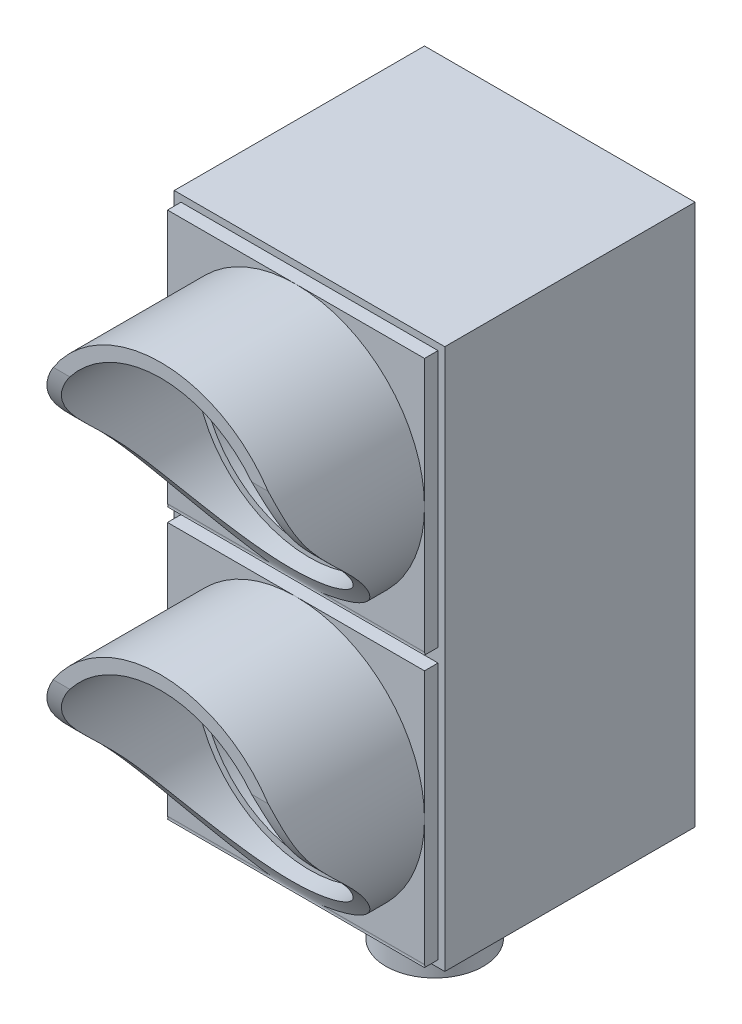
from build123d import *
from build123d.topology import SkipClean

# Parameters (mm, degrees)
SKETCH1_W                  = 40
SKETCH1_H                  = 40
BOSS_EXTRUDE1_DEPTH        = 15
SKETCH4_W                  = 38
SKETCH4_H                  = 38
BOSS_EXTRUDE2_DEPTH        = 2
SKETCH6_R                  = 19
SKETCH6_R_2                = 17
BOSS_EXTRUDE4_DEPTH        = 20
ENL_V_MAT_EXTRU_1_DEPTH    = 216.409731765
ESQUISSE3_R                = 16
ENL_V_MAT_EXTRU_7_DEPTH    = 224.368324091
ESQUISSE3_4_R              = 17
ESQUISSE3_4_R_2            = 16
ENL_V_MAT_EXTRU_8_DEPTH    = 2
ENL_V_START                = -2
SKETCH4_2_W                = 38
SKETCH4_2_H                = 38
ENL_V_MAT_EXTRU_9_DEPTH    = 222.556275259
ESQUISSE7_W                = 40
ESQUISSE7_H                = 40
BOSS_EXTRU_1_DEPTH         = 2
ESQUISSE8_R                = 1.5
ENL_V_MAT_EXTRU_10_DEPTH   = 2
R_P_TITION_LIN_AIRE1_COUNT = 2
R_P_TITION_LIN_AIRE1_PITCH = 40
ESQUISSE9_W                = 40
ESQUISSE9_H                = 80
ESQUISSE9_W_2              = 36
ESQUISSE9_H_2              = 76
BOSS_EXTRU_2_DEPTH         = 20
ESQUISSE10_R               = 2.5
ESQUISSE10_R_2             = 1.5
BOSS_EXTRU_8_DEPTH         = 12
ESQUISSE10_4_R             = 1.5
BOSS_EXTRU_9_DEPTH         = 7
ESQUISSE11_R               = 7.2
ESQUISSE11_R_2             = 5.2
BOSS_EXTRU_10_DEPTH        = 15
ESQUISSE11_2_R             = 5.2
ENL_V_MAT_EXTRU_12_DEPTH   = 2
ESQUISSE13_W               = 9
ESQUISSE13_H               = 4
ENL_V_MAT_EXTRU_13_DEPTH   = 2


with BuildPart() as part:
    # Sketch1 → Boss-Extrude1 (new body)
    with BuildSketch(Plane.XY):
        with Locations((-57.34375, 188.59375)):
            Rectangle(SKETCH1_W, SKETCH1_H)
    extrude(amount=BOSS_EXTRUDE1_DEPTH)

    # Sketch4 → Boss-Extrude2 (add)
    with BuildSketch(Plane.XY.offset(15)):
        with Locations((-57.34375, 188.59375)):
            Rectangle(SKETCH4_W, SKETCH4_H)
    extrude(amount=BOSS_EXTRUDE2_DEPTH)

    # Sketch6 → Boss-Extrude4 (add)
    with BuildSketch(Plane.XY.offset(17)):
        with Locations((-57.34375, 188.59375)):
            Circle(SKETCH6_R)
        with Locations((-57.34375, 188.59375)):
            Circle(SKETCH6_R_2, mode=Mode.SUBTRACT)
    extrude(amount=BOSS_EXTRUDE4_DEPTH)

    # Sketch8 → Enlèv. mat.-Extru.1 (cut, through all)
    with BuildSketch(Plane(origin=(-38.34375, 0, 0), x_dir=(0, 0, -1), z_dir=(1, 0, 0))):
        with BuildLine():
            Line((-37, 207.59375), (-205.499628683, 197.623288095))
            Line((-205.499628683, 197.623288095), (-205.499628683, 76.933932991))
            Line((-205.499628683, 76.933932991), (-192.249814342, 45.926786422))
            Line((-192.249814342, 45.926786422), (-17, 68.82437158))
            Line((-17, 68.82437158), (-17, 169.59375))
            add(Edge.make_bspline(
                [(-37, 207.59375), (-38.602349821, 191.852070618), (-28.700479497, 190.041130282), (-16.384432192, 169.883189568), (-17, 169.59375)],
                knots=[0, 0, 0, 0, 0.615781196, 1, 1, 1, 1], degree=3))
        make_face()
    extrude(amount=-ENL_V_MAT_EXTRU_1_DEPTH, mode=Mode.SUBTRACT)

    # Esquisse3 → Enlèv. mat.-Extru.7 (cut, through all)
    with BuildSketch(Plane.XY.offset(17)):
        with Locations((-57.34375, 188.59375)):
            Circle(ESQUISSE3_R)
    extrude(amount=-ENL_V_MAT_EXTRU_7_DEPTH, mode=Mode.SUBTRACT)

    # Esquisse3<4> → Enlèv. mat.-Extru.8 (cut)
    with SkipClean():  # the faces are left unmerged after this step: merging them gives an invalid solid
        with BuildSketch(Plane.XY.offset(17)):
            with Locations(Location((-57.34375, 188.59375, 0), (0, 0, 142.189607985))):
                Circle(ESQUISSE3_4_R)
            with Locations((-57.34375, 188.59375)):
                Circle(ESQUISSE3_4_R_2, mode=Mode.SUBTRACT)
        extrude(amount=-ENL_V_MAT_EXTRU_8_DEPTH, mode=Mode.SUBTRACT)

    # Sketch4<2> → Enlèv. mat.-Extru.9 (cut, through all)
    with SkipClean():  # the faces are left unmerged after this step: merging them gives an invalid solid
        with BuildSketch(Plane.XY.offset(15).offset(ENL_V_START)):
            with Locations((-57.34375, 188.59375)):
                Rectangle(SKETCH4_2_W, SKETCH4_2_H)
        extrude(amount=-ENL_V_MAT_EXTRU_9_DEPTH, mode=Mode.SUBTRACT)

    # Esquisse7 → Boss.-Extru.1 (add)
    with SkipClean():  # the faces are left unmerged after this step: merging them gives an invalid solid
        with BuildSketch(Plane(origin=(0, 0, 0), x_dir=(-1, 0, 0), z_dir=(0, 0, -1))):
            with Locations((57.34375, 188.59375)):
                Rectangle(ESQUISSE7_W, ESQUISSE7_H)
        extrude(amount=BOSS_EXTRU_1_DEPTH)

    # Esquisse8 → Enlèv. mat.-Extru.10 (cut)
    with SkipClean():  # the faces are left unmerged after this step: merging them gives an invalid solid
        with BuildSketch(Plane(origin=(0, 0, -2), x_dir=(-1, 0, 0), z_dir=(0, 0, -1))):
            with Locations((57.34375, 188.59375)):
                Circle(ESQUISSE8_R)
        extrude(amount=-ENL_V_MAT_EXTRU_10_DEPTH, mode=Mode.SUBTRACT)


with BuildPart() as r_p_tition_lin_aire1_1:
    # Répétition linéaire1: pattern copy
    add(part.part.moved(Location(Vector(0, 1, 0) * (1 * R_P_TITION_LIN_AIRE1_PITCH))))


with BuildPart() as part_1:
    with SkipClean():  # the faces are left unmerged after this step: merging them gives an invalid solid
        add(part.part)

        add(r_p_tition_lin_aire1_1.part)  # Boss.-Extru.2 merges Répétition linéaire1_1
        # Esquisse9 → Boss.-Extru.2 (add)
        with BuildSketch(Plane(origin=(0, 0, -2), x_dir=(-1, 0, 0), z_dir=(0, 0, -1))):
            with Locations((57.34375, 208.59375)):
                Rectangle(ESQUISSE9_W, ESQUISSE9_H)
            with Locations((57.34375, 208.59375)):
                Rectangle(ESQUISSE9_W_2, ESQUISSE9_H_2, mode=Mode.SUBTRACT)
        extrude(amount=BOSS_EXTRU_2_DEPTH)

    # Esquisse10 → Boss.-Extru.8 (add)
    # profile 1 of 10: a face of its own
    with BuildSketch(Plane(origin=(0, 0, -2), x_dir=(-1, 0, 0), z_dir=(0, 0, -1))):
        with BuildLine():
            Line((39.34375, 244.09375), (39.34375, 241.59375))
            Line((39.34375, 241.59375), (41.84375, 241.59375))
            ThreePointArc((41.84375, 241.59375), (40.075983047, 242.325983047), (39.34375, 244.09375))
        make_face()
    # profile 2 of 10: a face of its own
    with BuildSketch(Plane(origin=(0, 0, -2), x_dir=(-1, 0, 0), z_dir=(0, 0, -1))):
        with BuildLine():
            Line((44.34375, 241.59375), (44.34375, 244.09375))
            ThreePointArc((44.34375, 244.09375), (43.611516953, 242.325983047), (41.84375, 241.59375))
            Line((41.84375, 241.59375), (44.34375, 241.59375))
        make_face()
    # profile 3 of 10: a face of its own
    with BuildSketch(Plane(origin=(0, 0, -2), x_dir=(-1, 0, 0), z_dir=(0, 0, -1))):
        with BuildLine():
            Line((44.34375, 244.09375), (44.34375, 246.59375))
            Line((44.34375, 246.59375), (41.84375, 246.59375))
            ThreePointArc((41.84375, 246.59375), (43.611516953, 245.861516953), (44.34375, 244.09375))
        make_face()
    # profile 4 of 10: a face of its own
    with BuildSketch(Plane(origin=(0, 0, -2), x_dir=(-1, 0, 0), z_dir=(0, 0, -1))):
        with BuildLine():
            ThreePointArc((39.34375, 244.09375), (40.075983047, 245.861516953), (41.84375, 246.59375))
            Line((41.84375, 246.59375), (39.34375, 246.59375))
            Line((39.34375, 246.59375), (39.34375, 244.09375))
        make_face()
    # profile 5 of 10: a face of its own
    with BuildSketch(Plane(origin=(0, 0, -2), x_dir=(-1, 0, 0), z_dir=(0, 0, -1))):
        with Locations((41.84375, 244.09375)):
            Circle(ESQUISSE10_R)
        with Locations((41.84375, 244.09375)):
            Circle(ESQUISSE10_R_2, mode=Mode.SUBTRACT)
    # profile 6 of 10: a face of its own
    with BuildSketch(Plane(origin=(0, 0, -2), x_dir=(-1, 0, 0), z_dir=(0, 0, -1))):
        with BuildLine():
            ThreePointArc((72.84375, 170.59375), (71.075983039, 171.325983055), (70.34375, 173.093750022))
            Line((70.34375, 173.093750022), (70.34375, 170.59375))
            Line((70.34375, 170.59375), (72.84375, 170.59375))
        make_face()
    # profile 7 of 10: a face of its own
    with BuildSketch(Plane(origin=(0, 0, -2), x_dir=(-1, 0, 0), z_dir=(0, 0, -1))):
        with BuildLine():
            Line((72.84375, 175.59375), (70.34375, 175.59375))
            Line((70.34375, 175.59375), (70.34375, 173.093750022))
            ThreePointArc((70.34375, 173.093750022), (71.075983055, 174.861516961), (72.84375, 175.59375))
        make_face()
    # profile 8 of 10: a face of its own
    with BuildSketch(Plane(origin=(0, 0, -2), x_dir=(-1, 0, 0), z_dir=(0, 0, -1))):
        with Locations((72.84375, 173.09375)):
            Circle(ESQUISSE10_R)
        with Locations((72.84375, 173.09375)):
            Circle(ESQUISSE10_R_2, mode=Mode.SUBTRACT)
    # profile 9 of 10: a face of its own
    with BuildSketch(Plane(origin=(0, 0, -2), x_dir=(-1, 0, 0), z_dir=(0, 0, -1))):
        with BuildLine():
            Line((75.34375, 175.59375), (72.84375, 175.59375))
            ThreePointArc((72.84375, 175.59375), (74.611516953, 174.861516953), (75.34375, 173.09375))
            Line((75.34375, 173.09375), (75.34375, 175.59375))
        make_face()
    # profile 10 of 10: a face of its own
    with BuildSketch(Plane(origin=(0, 0, -2), x_dir=(-1, 0, 0), z_dir=(0, 0, -1))):
        with BuildLine():
            Line((75.34375, 170.59375), (75.34375, 173.09375))
            ThreePointArc((75.34375, 173.09375), (74.611516953, 171.325983047), (72.84375, 170.59375))
            Line((72.84375, 170.59375), (75.34375, 170.59375))
        make_face()
    extrude(amount=BOSS_EXTRU_8_DEPTH)

    # Esquisse10<4> → Boss.-Extru.9 (add)
    with BuildSketch(Plane(origin=(0, 0, -2), x_dir=(-1, 0, 0), z_dir=(0, 0, -1))):
        with Locations((41.84375, 244.09375)):
            Circle(ESQUISSE10_4_R)
        with Locations((72.84375, 173.09375)):
            Circle(ESQUISSE10_4_R)
    extrude(amount=BOSS_EXTRU_9_DEPTH)

    # Esquisse11 → Boss.-Extru.10 (add)
    with BuildSketch(Plane.XZ.offset(-168.59375)):
        with Locations(Location((-57.34375, -3.5, 0), (0, 0, 90))):
            Circle(ESQUISSE11_R)
        with Locations(Location((-57.34375, -3.5, 0), (0, 0, 270))):
            Circle(ESQUISSE11_R_2, mode=Mode.SUBTRACT)
    extrude(amount=BOSS_EXTRU_10_DEPTH)

    # Esquisse11<2> → Enlèv. mat.-Extru.12 (cut)
    with BuildSketch(Plane.XZ.offset(-168.59375).offset(ENL_V_START)):
        with Locations(Location((-57.34375, -3.5, 0), (0, 0, 42.304989707))):
            Circle(ESQUISSE11_2_R)
    extrude(amount=ENL_V_MAT_EXTRU_12_DEPTH, mode=Mode.SUBTRACT)

    # Esquisse13 → Enlèv. mat.-Extru.13 (cut)
    with BuildSketch(Plane.ZY.offset(77.34375)):
        with Locations((-12.5, 185.59375)):
            Rectangle(ESQUISSE13_W, ESQUISSE13_H)
    extrude(amount=-ENL_V_MAT_EXTRU_13_DEPTH, mode=Mode.SUBTRACT)


solid = part_1.part
